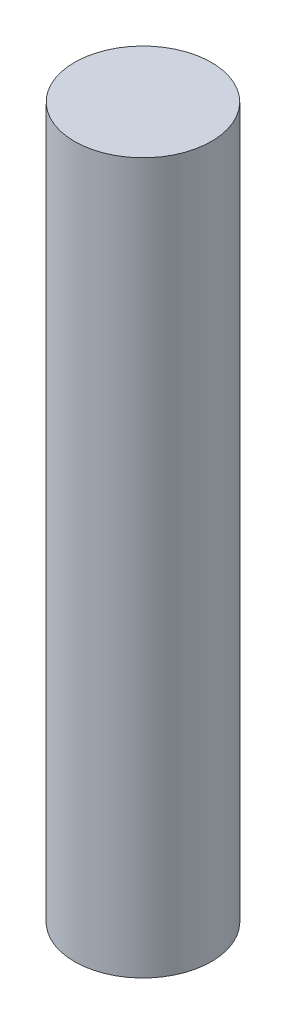
from build123d import *

# Parameters (mm, degrees)
SKETCH1_R           = 5.000000033
BOSS_EXTRUDE1_DEPTH = 51.880000126


with BuildPart() as part:
    # Sketch1 → Boss-Extrude1 (new body)
    with BuildSketch(Plane(origin=(0, 0, 0), x_dir=(1, 0, 0), z_dir=(0, 1, 0))):
        with Locations(Location((0, 0, 0), (0, 0, 270))):
            Circle(SKETCH1_R)
    extrude(amount=BOSS_EXTRUDE1_DEPTH)


solid = part.part
